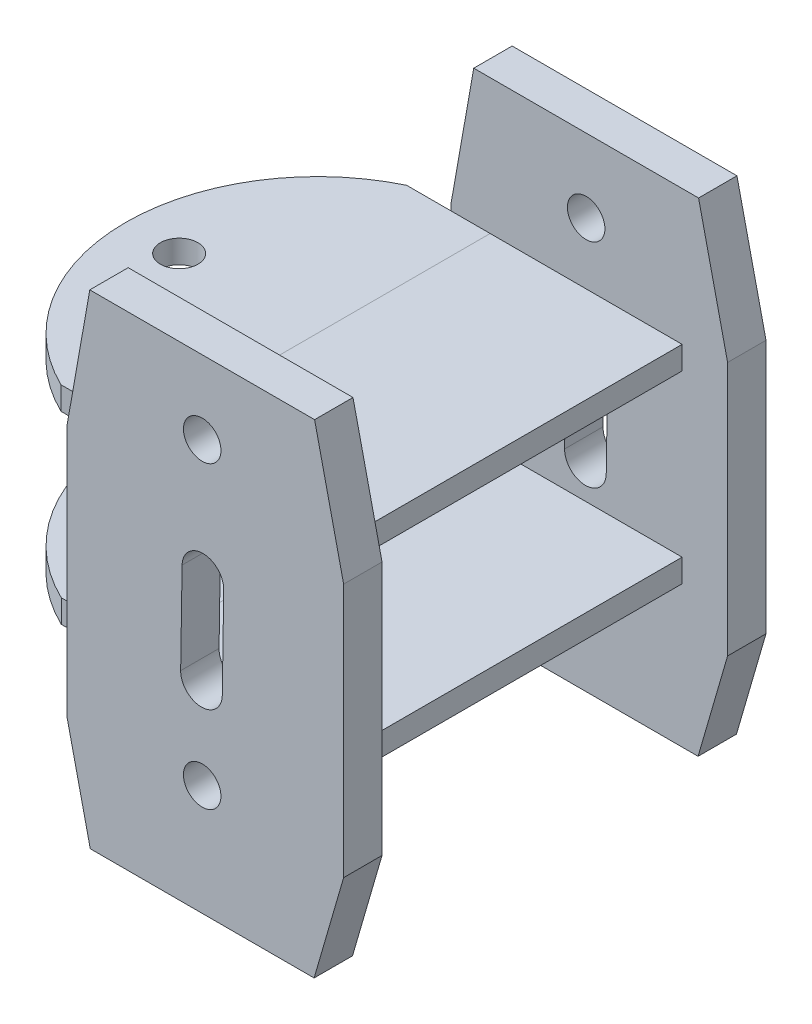
from build123d import *

# Parameters (mm, degrees)
SKETCH_1_R           = 2.44
SKETCH_1_W           = 25
SKETCH_1_H           = 3
EXTRUDE_1_DEPTH      = 5
EXTRUDE_5_DEPTH      = 22.5
EXTRUDE_5_DEPTH_BACK = 5
SKETCH_6_W           = 25
SKETCH_6_H           = 3
SKETCH_7_W           = 45
SKETCH_7_H           = 3
EXTRUDE_6_DEPTH      = 25
CUT_EXTRUDE_1_DEPTH  = 3
SKETCH_9_W           = 45
SKETCH_9_H           = 3
EXTRUDE_7_DEPTH      = 25
CUT_EXTRUDE_2_DEPTH  = 3
SKETCH_11_R          = 2.44
CUT_EXTRUDE_4_DEPTH  = 27


with BuildPart() as part:
    # 草图1 → 凸台-拉伸1 (new body)
    with BuildSketch(Plane.XY):
        Polygon((17.696605027, 40.469491525), (-11.579043351, 40.469491525), (-14.522033898, 23.811864407), (-14.522033898, -9.289830508), (-11.516336634, -22.530508475), (17.633898309, -22.530508475), (21.477966102, -9.289830508), (21.477966102, 23.811864407), align=None)
        with Locations((3.058780838, 30.892569201)):
            Circle(SKETCH_1_R, mode=Mode.SUBTRACT)
        with Locations((3.058780838, -8.107430799)):
            Circle(SKETCH_1_R, mode=Mode.SUBTRACT)
        with Locations((3.058780838, 21.392569201)):
            Rectangle(SKETCH_1_W, SKETCH_1_H, mode=Mode.SUBTRACT)
        with Locations((3.058780838, -2.607430799)):
            Rectangle(SKETCH_1_W, SKETCH_1_H, mode=Mode.SUBTRACT)
        with BuildLine():
            Line((0.254992558, 3.443382419), (0.442492558, 15.443382419))
            ThreePointArc((0.442492558, 15.443382419), (3.194875186, 18.111076351), (5.862569118, 15.358693723))
            Line((5.862569118, 15.358693723), (5.675069118, 3.358693723))
            ThreePointArc((5.675069118, 3.358693723), (2.92268649, 0.690999791), (0.254992558, 3.443382419))
        make_face(mode=Mode.SUBTRACT)
    extrude(amount=EXTRUDE_1_DEPTH)

    # 草图6 → 凸台-拉伸5 (add, two sides: drawn at the far end of the back side and taken through both)
    with BuildSketch(Plane(origin=(0, 0, 0), x_dir=(-1, 0, 0), z_dir=(0, 0, -1)).offset(-EXTRUDE_5_DEPTH_BACK)):
        with Locations((-3.058780838, 21.392569201)):
            Rectangle(SKETCH_6_W, SKETCH_6_H)
        with Locations((-3.058780838, -2.607430799)):
            Rectangle(SKETCH_6_W, SKETCH_6_H)
    extrude(amount=EXTRUDE_5_DEPTH + EXTRUDE_5_DEPTH_BACK)

    # 镜向2: part across plane


with BuildPart() as part_1:
    add(part.part)
    add(part.part.mirror(Plane(origin=(0, 0, -22.5), x_dir=(1, 0, 0), z_dir=(0, 0, -1))))


with BuildPart() as body_2:
    # 草图7 → 凸台-拉伸6 (new body)
    with BuildSketch(Plane.ZY.offset(9.441219162)):
        with Locations((-22.5, 21.392569201)):
            Rectangle(SKETCH_7_W, SKETCH_7_H)
    extrude(amount=EXTRUDE_6_DEPTH)

    # 草图8 → 切除-拉伸1 (cut)
    with BuildSketch(Plane(origin=(0, 22.892569201, 0), x_dir=(1, 0, 0), z_dir=(0, 1, 0))):
        with BuildLine():
            Line((-34.441219162, 0), (-20.325379476, 0))
            ThreePointArc((-20.325379476, 0), (-34.428132117, 22.5), (-20.325379476, 45))
            Line((-20.325379476, 45), (-34.441219162, 45))
            Line((-34.441219162, 45), (-34.441219162, 0))
        make_face()
    extrude(amount=-CUT_EXTRUDE_1_DEPTH, mode=Mode.SUBTRACT)


with BuildPart() as body_3:
    # 草图9 → 凸台-拉伸7 (new body)
    with BuildSketch(Plane.ZY.offset(9.441219162)):
        with Locations((-22.5, -2.607430799)):
            Rectangle(SKETCH_9_W, SKETCH_9_H)
    extrude(amount=EXTRUDE_7_DEPTH)

    # 草图10 → 切除-拉伸2 (cut)
    with BuildSketch(Plane(origin=(0, -1.107430799, 0), x_dir=(1, 0, 0), z_dir=(0, 1, 0))):
        with BuildLine():
            ThreePointArc((-34.441219162, 22.5), (-30.609078149, 35.790297055), (-20.289258761, 45))
            Line((-20.289258761, 45), (-34.441219162, 45))
            Line((-34.441219162, 45), (-34.441219162, 22.5))
        make_face()
        with BuildLine():
            Line((-34.441219162, 0), (-20.289258761, 0))
            ThreePointArc((-20.289258761, 0), (-30.609078149, 9.209702945), (-34.441219162, 22.5))
            Line((-34.441219162, 22.5), (-34.441219162, 0))
        make_face()
    extrude(amount=-CUT_EXTRUDE_2_DEPTH, mode=Mode.SUBTRACT)


with BuildPart() as cut_extrude_4_tool:
    # 草图11 → 切除-拉伸4 (new body)
    with BuildSketch(Plane(origin=(0, 22.892569201, 0), x_dir=(1, 0, 0), z_dir=(0, 1, 0))):
        with Locations(Location((-27.441219162, 22.5, 0), (0, 0, 270))):
            Circle(SKETCH_11_R)
    extrude(amount=-CUT_EXTRUDE_4_DEPTH)


with BuildPart() as body_2_1:
    add(body_2.part)

    # 切除-拉伸4: cut by cut_extrude_4_tool
    add(cut_extrude_4_tool.part, mode=Mode.SUBTRACT)


with BuildPart() as body_3_1:
    add(body_3.part)

    # 切除-拉伸4: cut by cut_extrude_4_tool
    add(cut_extrude_4_tool.part, mode=Mode.SUBTRACT)


solid = Compound([part_1.part, body_2_1.part, body_3_1.part])
